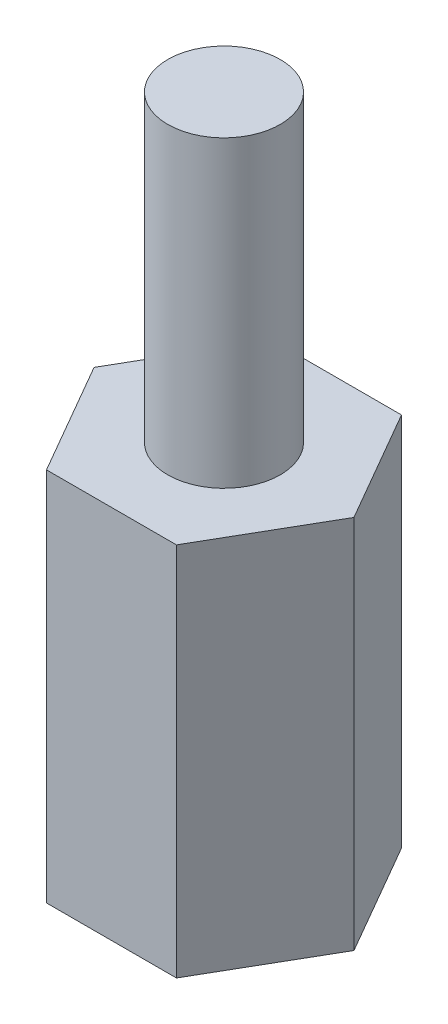
from build123d import *

# Parameters (mm, degrees)
BOSS_EXTRUDE1_DEPTH = 10
SKETCH5_R           = 1.5
BOSS_EXTRUDE2_DEPTH = 8.091605471
SKETCH6_R           = 1.5
CUT_EXTRUDE1_DEPTH  = 4


with BuildPart() as part:
    # Sketch3 → Boss-Extrude1 (new body)
    with BuildSketch(Plane(origin=(0, 0, 0), x_dir=(1, 0, 0), z_dir=(0, 1, 0))):
        Polygon((-3.464101615, 0), (-1.732050808, -3), (1.732050808, -3), (3.464101615, 0), (1.732050808, 3), (-1.732050808, 3), align=None)
    extrude(amount=BOSS_EXTRUDE1_DEPTH)

    # Sketch5 → Boss-Extrude2 (add)
    with BuildSketch(Plane(origin=(0, 10, 0), x_dir=(1, 0, 0), z_dir=(0, 1, 0))):
        with Locations(Location((0, 0, 0), (0, 0, 270))):
            Circle(SKETCH5_R)
    extrude(amount=BOSS_EXTRUDE2_DEPTH)

    # Sketch6 → Cut-Extrude1 (cut)
    with BuildSketch(Plane.XZ):
        with Locations(Location((0, 0, 0), (0, 0, 90))):
            Circle(SKETCH6_R)
    extrude(amount=-CUT_EXTRUDE1_DEPTH, mode=Mode.SUBTRACT)


solid = part.part
